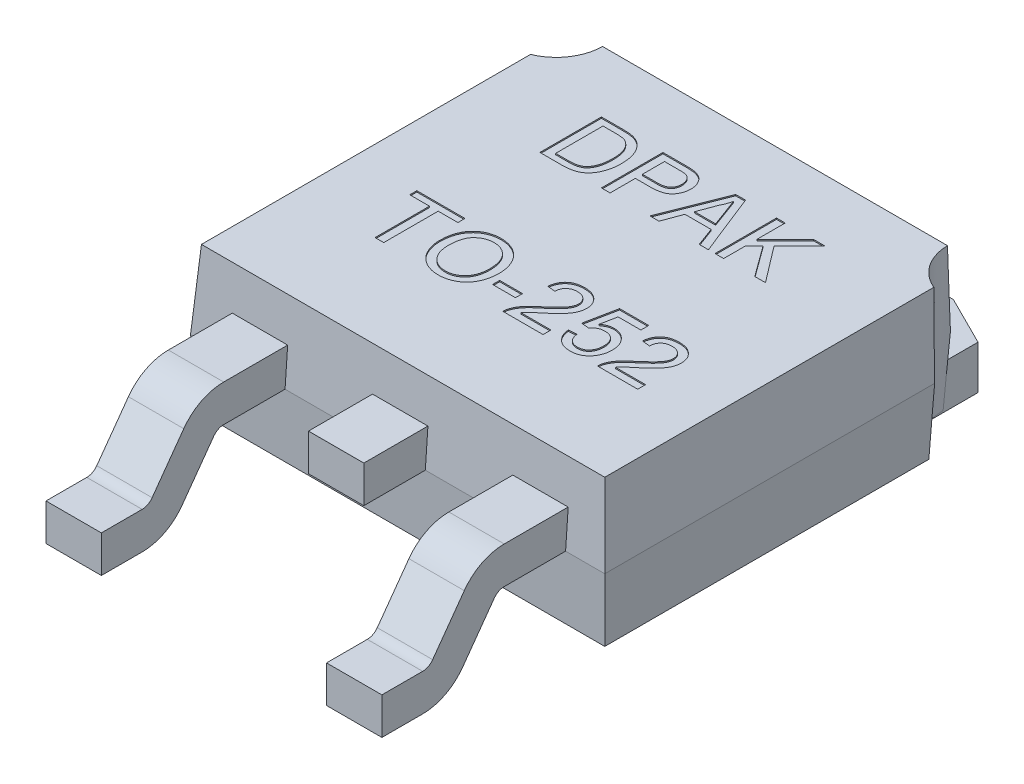
from build123d import *

# Parameters (mm, degrees)
SKETCH1_W                    = 6.58
SKETCH1_H                    = 6.07
BOSS_EXTRUDE1_DEPTH          = 1.1
BOSS_EXTRUDE1_DRAFT          = -4
BOSS_EXTRUDE2_DEPTH          = 0.68
BOSS_EXTRUDE2_DEPTH_BACK     = 0.03
CUT_EXTRUDE1_DEPTH           = 6.344296633
CUT_EXTRUDE1_DEPTH_BACK      = 6.344296633
SKETCH4_W                    = 0.22
SKETCH4_H                    = 3.853578182
CUT_EXTRUDE2_DEPTH           = 0.03
BOSS_EXTRUDE3_DEPTH          = 0.45
LPATTERN1_COUNT              = 2
LPATTERN1_PITCH              = 2.28
LPATTERN1_COL_COUNT          = 2
LPATTERN1_COL_PITCH          = 2.28
SKETCH6_W                    = 1.328337758
SKETCH6_H                    = 2.20416708
CUT_EXTRUDE3_DEPTH           = 8.177439149
SKETCH7_W                    = 6.733838986
SKETCH7_H                    = 6.223838986
BOSS_EXTRUDE4_DEPTH          = 1.27
BOSS_EXTRUDE4_TAPER          = 4
SKETCH8_W                    = 0.371794872
SKETCH8_H                    = 0.115384615
CUT_EXTRUDE4_DEPTH           = 0.02
SKETCH9_R                    = 0.848920415
CUT_EXTRUDE7_DEPTH           = 8.35796406
CUT_EXTRUDE7_DRAFT           = -2
CUT_EXTRUDE7_PROFILE_2_DEPTH = 8.35796406
CUT_EXTRUDE7_PROFILE_2_DRAFT = -2


with BuildPart() as part:
    # Sketch1 → Boss-Extrude1 (with draft: the straight prism first)
    with BuildSketch(Plane(origin=(0, 0, 0), x_dir=(1, 0, 0), z_dir=(0, 1, 0))):
        Rectangle(SKETCH1_W, SKETCH1_H)
    extrude(amount=BOSS_EXTRUDE1_DEPTH)
    # Boss-Extrude1: the draft: its side faces are tilted about the plane it starts from
    boss_extrude1_sides = [part.faces().sort_by_distance(p)[0] for p in [
        (3.29, 0.55, 0),
        (0, 0.55, -3.035),
        (-3.29, 0.55, 0),
        (0, 0.55, 3.035),
    ]]
    draft(boss_extrude1_sides, Plane(origin=(0, 0, 0), x_dir=(1, 0, 0), z_dir=(0, 1, 0)), BOSS_EXTRUDE1_DRAFT)

    # Sketch2 → Boss-Extrude2 (add, two sides: drawn at the far end of the back side and taken through both)
    with BuildSketch(Plane(origin=(0, 0, 0), x_dir=(1, 0, 0), z_dir=(0, 1, 0)).offset(-BOSS_EXTRUDE2_DEPTH_BACK)):
        Polygon((2.72, 0), (2.72, 3.601919493), (1.92, 4.001919493), (-1.92, 4.001919493), (-2.72, 3.601919493), (-2.72, 0), (-2.72, -1.498080507), (2.72, -1.498080507), align=None)
    extrude(amount=BOSS_EXTRUDE2_DEPTH + BOSS_EXTRUDE2_DEPTH_BACK)

    # Sketch3 → Cut-Extrude1 (cut, two sides: drawn at the far end of the back side and taken through both)
    with BuildSketch(Plane(origin=(0, 0, 0), x_dir=(1, 0, 0), z_dir=(0, 1, 0)).offset(-CUT_EXTRUDE1_DEPTH_BACK)):
        with BuildLine():
            Line((-1, 4.001919493), (-1, 3.675595954))
            ThreePointArc((-1, 3.675595954), (-0.985355339, 3.640240615), (-0.95, 3.625595954))
            Line((-0.95, 3.625595954), (0.95, 3.625595954))
            ThreePointArc((0.95, 3.625595954), (0.985355339, 3.640240615), (1, 3.675595954))
            Line((1, 3.675595954), (1, 4.001919493))
            Line((1, 4.001919493), (-1, 4.001919493))
        make_face()
    extrude(amount=CUT_EXTRUDE1_DEPTH + CUT_EXTRUDE1_DEPTH_BACK, mode=Mode.SUBTRACT)

    # Sketch4 → Cut-Extrude2 (cut)
    with BuildSketch(Plane.XZ.offset(0.03)):
        with BuildLine():
            Line((0, -1.855497675), (-1, -1.855497675))
            ThreePointArc((-1, -1.855497675), (-1.241809855, -2.105497675), (-1, -2.355497675))
            Line((-1, -2.355497675), (0, -2.355497675))
            Line((0, -2.355497675), (1, -2.355497675))
            ThreePointArc((1, -2.355497675), (1.241809855, -2.105497675), (1, -1.855497675))
            Line((1, -1.855497675), (0, -1.855497675))
        make_face()
        with Locations((-2.61, -0.428708584)):
            Rectangle(SKETCH4_W, SKETCH4_H)
        with Locations((2.61, -0.428708584)):
            Rectangle(SKETCH4_W, SKETCH4_H)
    extrude(amount=-CUT_EXTRUDE2_DEPTH, mode=Mode.SUBTRACT)

    # Sketch5 → Boss-Extrude3 (add, symmetric)
    with BuildSketch(Plane(origin=(0, 0, 0), x_dir=(0, 0, -1), z_dir=(1, 0, 0))):
        with BuildLine():
            Line((0, 1.1), (-4.109468706, 1.1))
            ThreePointArc((-4.109468706, 1.1), (-4.200652173, 1.078004425), (-4.271779313, 1.016855753))
            Line((-4.271779313, 1.016855753), (-4.786025331, 0.302576987))
            ThreePointArc((-4.786025331, 0.302576987), (-5.070533888, 0.0579823), (-5.435267757, -0.03))
            Line((-5.435267757, -0.03), (-6.098080507, -0.03))
            Line((-6.098080507, -0.03), (-6.098080507, 0.57))
            Line((-6.098080507, 0.57), (-5.435267757, 0.57))
            ThreePointArc((-5.435267757, 0.57), (-5.34408429, 0.591995575), (-5.27295715, 0.653144247))
            Line((-5.27295715, 0.653144247), (-4.758711132, 1.367423013))
            ThreePointArc((-4.758711132, 1.367423013), (-4.474202575, 1.6120177), (-4.109468706, 1.7))
            Line((-4.109468706, 1.7), (0, 1.7))
            Line((0, 1.7), (0, 1.1))
        make_face()
    boss_extrude3 = extrude(amount=BOSS_EXTRUDE3_DEPTH, both=True)

    # LPattern1: Boss-Extrude3 ×2
    with Locations(*[(i * LPATTERN1_PITCH, 0, 0) for i in range(1, LPATTERN1_COUNT)]):
        add(boss_extrude3)

    # LPattern1 col: Boss-Extrude3 ×2
    with Locations(*[(-i * LPATTERN1_COL_PITCH, 0, 0) for i in range(1, LPATTERN1_COL_COUNT)]):
        add(boss_extrude3)

    # Sketch6 → Cut-Extrude3 (cut, through all)
    with BuildSketch(Plane(origin=(0, 1.7, 0), x_dir=(1, 0, 0), z_dir=(0, 1, 0))):
        with Locations((0.009170669, -5.214003033)):
            Rectangle(SKETCH6_W, SKETCH6_H)
    extrude(amount=-CUT_EXTRUDE3_DEPTH, mode=Mode.SUBTRACT)

    # Sketch7 → Boss-Extrude4 (add)
    with BuildSketch(Plane(origin=(0, 1.1, 0), x_dir=(1, 0, 0), z_dir=(0, 1, 0))):
        Rectangle(SKETCH7_W, SKETCH7_H)
    extrude(amount=BOSS_EXTRUDE4_DEPTH, taper=BOSS_EXTRUDE4_TAPER)

    # Sketch8 → Cut-Extrude4 (cut)
    # profile 1 of 10: a face of its own
    with BuildSketch(Plane(origin=(0, 2.37, 0), x_dir=(1, 0, 0), z_dir=(0, 1, 0))):
        with BuildLine():
            Line((-1.821910054, 1.022300033), (-1.821910054, 2.022300033))
            Line((-1.821910054, 2.022300033), (-1.479962939, 2.022300033))
            add(Edge.make_bspline(
                [(-1.479962939, 2.022300033), (-1.470614561, 2.022257801), (-1.452449946, 2.02217574), (-1.426063998, 2.021652732), (-1.401357101, 2.020391242), (-1.378443103, 2.01885458), (-1.357206436, 2.016808647), (-1.337674233, 2.014520785), (-1.319831253, 2.011536567), (-1.308613176, 2.009056126), (-1.303280247, 2.007876956)],
                knots=[0, 0, 0, 0, 1.263127796, 2.454354013, 3.565393221, 4.605443485, 5.557051711, 6.447822442, 7.26211484, 8, 8, 8, 8], degree=3))
            add(Edge.make_bspline(
                [(-1.303280247, 2.007876956), (-1.289488374, 2.004258497), (-1.262392892, 1.997149681), (-1.224144769, 1.981159317), (-1.189031327, 1.961102324), (-1.168206846, 1.944581125), (-1.157847554, 1.936362533)],
                knots=[0, 0, 0, 0, 1.04477941, 2.052571232, 3.03123721, 4, 4, 4, 4], degree=3))
            add(Edge.make_bspline(
                [(-1.157847554, 1.936362533), (-1.151415529, 1.930714171), (-1.138522364, 1.91939188), (-1.120813678, 1.900737577), (-1.104385623, 1.880948394), (-1.088747518, 1.860365017), (-1.074899561, 1.838237031), (-1.061919045, 1.815201338), (-1.050596891, 1.79079535), (-1.040175019, 1.765417932), (-1.030889843, 1.738970171), (-1.023260536, 1.711469145), (-1.016251631, 1.683202032), (-1.011038634, 1.653859839), (-1.006487956, 1.623691452), (-1.003599064, 1.592524197), (-1.001724653, 1.560451114), (-1.001507436, 1.538729105), (-1.001397234, 1.527708687)],
                knots=[0, 0, 0, 0, 0.908997367, 1.822109427, 2.728529095, 3.640759027, 4.565643067, 5.499218265, 6.448003669, 7.421473682, 8.413047621, 9.423472075, 10.452328391, 11.505545429, 12.587978234, 13.692612971, 14.829372988, 16, 16, 16, 16], degree=3))
            add(Edge.make_bspline(
                [(-1.001397234, 1.527708687), (-1.001665856, 1.509266233), (-1.002188589, 1.473377652), (-1.007358215, 1.42117838), (-1.015357772, 1.372112772), (-1.026999995, 1.326475454), (-1.041338608, 1.284519546), (-1.056980791, 1.245902384), (-1.074986055, 1.211289377), (-1.094737425, 1.180387936), (-1.115900495, 1.153002541), (-1.138071323, 1.128722186), (-1.161315631, 1.107536126), (-1.185515342, 1.088888354), (-1.211927282, 1.073447487), (-1.240274367, 1.059582888), (-1.271476265, 1.048442689), (-1.304945388, 1.03869811), (-1.341074846, 1.031397707), (-1.379668995, 1.026033135), (-1.420879512, 1.022789112), (-1.449174363, 1.022466218), (-1.463736977, 1.022300033)],
                knots=[0, 0, 0, 0, 1.410753827, 2.745293735, 4.009435601, 5.211453015, 6.344066657, 7.400119332, 8.396481539, 9.324811333, 10.202671465, 11.041621015, 11.837259285, 12.606727868, 13.374311266, 14.17412185, 15.017911533, 15.905707008, 16.839601966, 17.835295848, 18.885883805, 20, 20, 20, 20], degree=3))
            Line((-1.463736977, 1.022300033), (-1.821910054, 1.022300033))
        make_face()
        with BuildLine():
            Line((-1.680884413, 1.137684649), (-1.474754606, 1.137684649))
            add(Edge.make_bspline(
                [(-1.474754606, 1.137684649), (-1.459724133, 1.137909649), (-1.431289827, 1.138335299), (-1.391173512, 1.141604279), (-1.356161214, 1.147242831), (-1.325864684, 1.155264968), (-1.299577715, 1.165638824), (-1.276431911, 1.177903199), (-1.255843429, 1.191820508), (-1.244245934, 1.202954937), (-1.238576721, 1.20839779)],
                knots=[0, 0, 0, 0, 1.423649224, 2.693227144, 3.808972214, 4.778671344, 5.656058397, 6.479437267, 7.256702014, 8, 8, 8, 8], degree=3))
            add(Edge.make_bspline(
                [(-1.238576721, 1.20839779), (-1.231199371, 1.216833232), (-1.216043757, 1.234162532), (-1.197171087, 1.264435898), (-1.1807132, 1.29849923), (-1.166955341, 1.336715155), (-1.155674253, 1.378954412), (-1.148150198, 1.425595343), (-1.143230908, 1.476320812), (-1.142698926, 1.51160356), (-1.142422875, 1.529912213)],
                knots=[0, 0, 0, 0, 0.782184731, 1.606876467, 2.483531085, 3.422528604, 4.441347086, 5.534669947, 6.720709839, 8, 8, 8, 8], degree=3))
            add(Edge.make_bspline(
                [(-1.142422875, 1.529912213), (-1.142593915, 1.54266806), (-1.142926409, 1.567464911), (-1.144999228, 1.603589765), (-1.149091277, 1.637399014), (-1.154324625, 1.668951135), (-1.161469941, 1.698145835), (-1.169640733, 1.725262831), (-1.179919869, 1.749947636), (-1.191649624, 1.772390819), (-1.204517301, 1.792741425), (-1.217925883, 1.811436573), (-1.231943987, 1.828414967), (-1.246868647, 1.843435036), (-1.26225121, 1.856940955), (-1.278378448, 1.868656215), (-1.295205231, 1.878577214), (-1.307029304, 1.883727281), (-1.312895631, 1.886282405)],
                knots=[0, 0, 0, 0, 1.460126857, 2.838427476, 4.139102445, 5.35666337, 6.496721546, 7.577303074, 8.594995104, 9.55219858, 10.472533725, 11.348579167, 12.184287935, 12.989560785, 13.769667798, 14.524891986, 15.268148459, 16, 16, 16, 16], degree=3))
            add(Edge.make_bspline(
                [(-1.312895631, 1.886282405), (-1.317479346, 1.887959846), (-1.327191938, 1.891514235), (-1.343043829, 1.895537268), (-1.360734699, 1.899239573), (-1.380438922, 1.901838108), (-1.402056844, 1.904363601), (-1.425722841, 1.90589829), (-1.451312795, 1.906593771), (-1.469011727, 1.906805815), (-1.478160054, 1.906915418)],
                knots=[0, 0, 0, 0, 0.699400087, 1.48198292, 2.341906832, 3.289648813, 4.329964754, 5.462247508, 6.688271602, 8, 8, 8, 8], degree=3))
            Line((-1.478160054, 1.906915418), (-1.680884413, 1.906915418))
            Line((-1.680884413, 1.906915418), (-1.680884413, 1.137684649))
        make_face(mode=Mode.SUBTRACT)
    # profile 2 of 10: a face of its own
    with BuildSketch(Plane(origin=(0, 2.37, 0), x_dir=(1, 0, 0), z_dir=(0, 1, 0))):
        with BuildLine():
            Line((-0.821910054, 1.022300033), (-0.821910054, 2.022300033))
            Line((-0.821910054, 2.022300033), (-0.454522234, 2.022300033))
            add(Edge.make_bspline(
                [(-0.454522234, 2.022300033), (-0.439294305, 2.022213278), (-0.410696183, 2.022050353), (-0.370759272, 2.020142282), (-0.336464799, 2.017781682), (-0.315750799, 2.014420802), (-0.306285054, 2.012884969)],
                knots=[0, 0, 0, 0, 1.22865052, 2.30741144, 3.226532197, 4, 4, 4, 4], degree=3))
            add(Edge.make_bspline(
                [(-0.306285054, 2.012884969), (-0.29473913, 2.01066293), (-0.272359912, 2.006356), (-0.240674406, 1.995972924), (-0.211807075, 1.983051979), (-0.185803033, 1.966953814), (-0.162230272, 1.948042409), (-0.14142473, 1.925382106), (-0.122982188, 1.89947887), (-0.107300394, 1.870352969), (-0.094247703, 1.839013512), (-0.085105547, 1.805626146), (-0.07924998, 1.770770931), (-0.078633643, 1.746950073), (-0.078320311, 1.734840097)],
                knots=[0, 0, 0, 0, 1.070909925, 2.075721949, 3.031861647, 3.947440733, 4.85625699, 5.777986723, 6.742441087, 7.747548058, 8.78749499, 9.830146138, 10.896896232, 12, 12, 12, 12], degree=3))
            add(Edge.make_bspline(
                [(-0.078320311, 1.734840097), (-0.078541129, 1.724478807), (-0.0789756, 1.704092399), (-0.082706335, 1.674141825), (-0.08859051, 1.645328154), (-0.097367556, 1.617848564), (-0.108097731, 1.591381791), (-0.12162023, 1.566374204), (-0.137410694, 1.54248622), (-0.155527256, 1.519782841), (-0.176855481, 1.498724771), (-0.202515958, 1.480861138), (-0.232013951, 1.465860707), (-0.265356338, 1.453740522), (-0.302462181, 1.444203889), (-0.343453059, 1.437216534), (-0.388408822, 1.433358933), (-0.419659237, 1.43283079), (-0.435892426, 1.432556443)],
                knots=[0, 0, 0, 0, 0.928769099, 1.82740408, 2.702266355, 3.562020322, 4.410419678, 5.259600434, 6.10654066, 6.975254961, 7.860221694, 8.783881459, 9.766664779, 10.81996744, 11.958551584, 13.197863772, 14.544415867, 16, 16, 16, 16], degree=3))
            Line((-0.435892426, 1.432556443), (-0.680884413, 1.432556443))
            Line((-0.680884413, 1.432556443), (-0.680884413, 1.022300033))
            Line((-0.680884413, 1.022300033), (-0.821910054, 1.022300033))
        make_face()
        with BuildLine():
            Line((-0.680884413, 1.547941059), (-0.439698516, 1.547941059))
            add(Edge.make_bspline(
                [(-0.439698516, 1.547941059), (-0.430079075, 1.5481019), (-0.411548112, 1.548411744), (-0.384771717, 1.550574009), (-0.360197593, 1.55431679), (-0.337757575, 1.559536873), (-0.317423088, 1.566025287), (-0.299230516, 1.574231345), (-0.283273671, 1.584074977), (-0.26944682, 1.595455877), (-0.257578029, 1.608205261), (-0.247294004, 1.622114135), (-0.23855614, 1.637281895), (-0.231706688, 1.653771999), (-0.225904257, 1.671263685), (-0.222282493, 1.690119381), (-0.219764291, 1.710065651), (-0.219487354, 1.723813945), (-0.219345952, 1.730833687)],
                knots=[0, 0, 0, 0, 1.403696362, 2.704090955, 3.91683431, 5.027708188, 6.063065288, 7.026749679, 7.932587242, 8.790956304, 9.632005367, 10.468072405, 11.310475089, 12.179234342, 13.069796908, 13.994719932, 14.976123913, 16, 16, 16, 16], degree=3))
            add(Edge.make_bspline(
                [(-0.219345952, 1.730833687), (-0.219644682, 1.741013433), (-0.220223517, 1.760738227), (-0.226055426, 1.789121598), (-0.235198627, 1.815348336), (-0.248289, 1.838921886), (-0.264132159, 1.859602168), (-0.282755456, 1.876522043), (-0.303561824, 1.890048859), (-0.319096848, 1.895404819), (-0.326918067, 1.898101315)],
                knots=[0, 0, 0, 0, 1.143156811, 2.215038775, 3.243253804, 4.254666983, 5.233799895, 6.158487526, 7.072877374, 8, 8, 8, 8], degree=3))
            add(Edge.make_bspline(
                [(-0.326918067, 1.898101315), (-0.329782448, 1.89880172), (-0.336006945, 1.900323747), (-0.346317775, 1.90205127), (-0.358267485, 1.903687082), (-0.371914321, 1.904772367), (-0.38713383, 1.905850192), (-0.403972538, 1.906347043), (-0.422468805, 1.906776181), (-0.435357896, 1.906867587), (-0.442102362, 1.906915418)],
                knots=[0, 0, 0, 0, 0.611063981, 1.327884044, 2.165719042, 3.110592661, 4.16481496, 5.328235826, 6.601947678, 8, 8, 8, 8], degree=3))
            Line((-0.442102362, 1.906915418), (-0.680884413, 1.906915418))
            Line((-0.680884413, 1.906915418), (-0.680884413, 1.547941059))
        make_face(mode=Mode.SUBTRACT)
    # profile 3 of 10: a face of its own
    with BuildSketch(Plane(origin=(0, 2.37, 0), x_dir=(1, 0, 0), z_dir=(0, 1, 0))):
        Polygon((-0.035652042, 1.022300033), (0.361383215, 2.022300033), (0.520437702, 2.022300033), (0.917472958, 1.022300033), (0.767833535, 1.022300033), (0.654051484, 1.329992341), (0.227769433, 1.329992341), (0.113987382, 1.022300033), align=None)
        with BuildLine():
            Line((0.270237382, 1.445376956), (0.611583535, 1.445376956))
            Line((0.611583535, 1.445376956), (0.514428087, 1.708197469))
            add(Edge.make_bspline(
                [(0.514428087, 1.708197469), (0.510703494, 1.718352496), (0.503421211, 1.73820749), (0.492561134, 1.76705512), (0.482639542, 1.794450014), (0.472910607, 1.819999368), (0.464128123, 1.844074311), (0.456033082, 1.86651223), (0.448027156, 1.887157168), (0.443222687, 1.900495926), (0.440910458, 1.906915418)],
                knots=[0, 0, 0, 0, 1.225184869, 2.395467751, 3.491410812, 4.525364584, 5.492066482, 6.394148129, 7.227157926, 8, 8, 8, 8], degree=3))
            add(Edge.make_bspline(
                [(0.440910458, 1.906915418), (0.437085587, 1.891085516), (0.429420072, 1.859360441), (0.413370351, 1.81287895), (0.395010028, 1.766822553), (0.380099257, 1.737144126), (0.372601164, 1.722219905)],
                knots=[0, 0, 0, 0, 0.9891762, 1.982431084, 2.985436691, 4, 4, 4, 4], degree=3))
            Line((0.372601164, 1.722219905), (0.270237382, 1.445376956))
        make_face(mode=Mode.SUBTRACT)
    # profile 4 of 10: a face of its own
    with BuildSketch(Plane(origin=(0, 2.37, 0), x_dir=(1, 0, 0), z_dir=(0, 1, 0))):
        Polygon((1.024243792, 1.022300033), (1.024243792, 2.022300033), (1.165269433, 2.022300033), (1.165269433, 1.561562854), (1.626006612, 2.022300033), (1.819115587, 2.022300033), (1.401246997, 1.604431443), (1.844756612, 1.022300033), (1.671078728, 1.022300033), (1.311904048, 1.514888174), (1.165269433, 1.368453879), (1.165269433, 1.022300033), align=None)
    # profile 5 of 10: a face of its own
    with BuildSketch(Plane(origin=(0, 2.37, 0), x_dir=(1, 0, 0), z_dir=(0, 1, 0))):
        Polygon((-1.962935695, -1.516161505), (-1.962935695, -0.631546121), (-2.283448516, -0.631546121), (-2.283448516, -0.516161505), (-1.501397234, -0.516161505), (-1.501397234, -0.631546121), (-1.821910054, -0.631546121), (-1.821910054, -1.516161505), align=None)
    # profile 6 of 10: a face of its own
    with BuildSketch(Plane(origin=(0, 2.37, 0), x_dir=(1, 0, 0), z_dir=(0, 1, 0))):
        with BuildLine():
            add(Edge.make_bspline(
                [(-1.398833131, -1.029382659), (-1.39848557, -1.009333521), (-1.397808364, -0.970268792), (-1.391480863, -0.913385513), (-1.381206626, -0.859865789), (-1.366518696, -0.809713788), (-1.347901702, -0.762850923), (-1.325269189, -0.719171079), (-1.297940386, -0.67916868), (-1.267024546, -0.642462931), (-1.232492973, -0.610012358), (-1.195726663, -0.5811916), (-1.156266519, -0.557151681), (-1.114477123, -0.537302633), (-1.07018093, -0.522063109), (-1.02350231, -0.511394055), (-0.974491187, -0.504511478), (-0.940990936, -0.503736822), (-0.923873195, -0.503340992)],
                knots=[0, 0, 0, 0, 1.203621547, 2.345195544, 3.432004029, 4.472479546, 5.478447225, 6.455936844, 7.420185704, 8.381829745, 9.332027588, 10.260832629, 11.182364398, 12.100723901, 13.034044877, 13.989196293, 14.972532542, 16, 16, 16, 16], degree=3))
            add(Edge.make_bspline(
                [(-0.923873195, -0.503340992), (-0.912582869, -0.503538143), (-0.890162323, -0.503929648), (-0.857015546, -0.506908477), (-0.824720525, -0.512225173), (-0.793309063, -0.51935014), (-0.762695656, -0.528697788), (-0.732862023, -0.539732402), (-0.704069324, -0.553405842), (-0.67612601, -0.568714619), (-0.64936193, -0.585838148), (-0.624209114, -0.604754475), (-0.600727812, -0.625320538), (-0.578602606, -0.647198286), (-0.558571783, -0.671126064), (-0.539807819, -0.696374989), (-0.522849907, -0.723392766), (-0.507637877, -0.75195803), (-0.494036776, -0.781629596), (-0.482412009, -0.81253044), (-0.472430034, -0.844289886), (-0.464074278, -0.877095915), (-0.458078798, -0.910937311), (-0.453304533, -0.945668256), (-0.450791705, -0.981402263), (-0.450342592, -1.005541221), (-0.450115183, -1.017764069)],
                knots=[0, 0, 0, 0, 1.034375294, 2.054082248, 3.045783978, 4.031219655, 5.002789406, 5.976610191, 6.94273282, 7.920236376, 8.894345378, 9.851183672, 10.800797181, 11.752517031, 12.698794154, 13.65688337, 14.632873302, 15.61821402, 16.620222298, 17.621258913, 18.640965868, 19.669244166, 20.720417492, 21.788124603, 22.880008887, 24, 24, 24, 24], degree=3))
            add(Edge.make_bspline(
                [(-0.450115183, -1.017764069), (-0.45032354, -1.030188473), (-0.450735185, -1.054735025), (-0.453520543, -1.090997793), (-0.458418171, -1.126219531), (-0.464914042, -1.160505266), (-0.473618309, -1.193783621), (-0.483961994, -1.226150007), (-0.496473265, -1.257411644), (-0.510603356, -1.287643879), (-0.526591549, -1.316430913), (-0.54422761, -1.343571454), (-0.563524034, -1.368811624), (-0.58418771, -1.392461055), (-0.60670119, -1.414096851), (-0.630787251, -1.433921323), (-0.656353282, -1.452121438), (-0.683485173, -1.468204279), (-0.711696004, -1.482301464), (-0.740427527, -1.494808207), (-0.769701086, -1.505474456), (-0.799616727, -1.51411839), (-0.830092845, -1.520650368), (-0.861043675, -1.525541583), (-0.89257068, -1.528357961), (-0.913785018, -1.52877293), (-0.924474157, -1.528982018)],
                knots=[0, 0, 0, 0, 1.141429366, 2.255090526, 3.338676798, 4.407031443, 5.458968682, 6.496860253, 7.526652771, 8.550250826, 9.560787671, 10.54935636, 11.521089193, 12.477323897, 13.431786008, 14.386110112, 15.340986122, 16.312041, 17.28047646, 18.236612773, 19.189437236, 20.140779471, 21.09494583, 22.051062463, 23.018000708, 24, 24, 24, 24], degree=3))
            add(Edge.make_bspline(
                [(-0.924474157, -1.528982018), (-0.935967356, -1.528811975), (-0.958732505, -1.528475162), (-0.992380007, -1.525113192), (-1.025190413, -1.51998439), (-1.057068337, -1.512579949), (-1.087970217, -1.502920333), (-1.117932619, -1.491228639), (-1.147060924, -1.477661124), (-1.174993696, -1.461829304), (-1.201635865, -1.444226023), (-1.226729205, -1.424938785), (-1.250259841, -1.404145338), (-1.271850201, -1.381501994), (-1.29219953, -1.35782958), (-1.310494171, -1.332248209), (-1.327331597, -1.305338039), (-1.342213561, -1.276839668), (-1.355657189, -1.247599959), (-1.366983735, -1.217609559), (-1.376937575, -1.187310448), (-1.3848648, -1.156515873), (-1.391181834, -1.125296872), (-1.395429582, -1.09370539), (-1.398497337, -1.06169438), (-1.398720637, -1.040207434), (-1.398833131, -1.029382659)],
                knots=[0, 0, 0, 0, 1.072727997, 2.12480551, 3.153819198, 4.171534612, 5.177148798, 6.173931848, 7.17235114, 8.174500385, 9.168706755, 10.151274001, 11.127173509, 12.097141049, 13.070188938, 14.039134204, 15.03036519, 16.031505612, 17.038625933, 18.033164522, 19.022845559, 20.014762458, 21.000193215, 21.994692725, 22.989758729, 24, 24, 24, 24], degree=3))
        make_face()
        with BuildLine():
            add(Edge.make_bspline(
                [(-1.25780749, -1.030985223), (-1.257591375, -1.045422412), (-1.257169966, -1.07357391), (-1.252348816, -1.114617298), (-1.245033492, -1.153343824), (-1.23495009, -1.189862204), (-1.221395527, -1.223811276), (-1.205189293, -1.255517258), (-1.185785719, -1.284769386), (-1.163612907, -1.31148583), (-1.139225354, -1.335485882), (-1.11316478, -1.35644865), (-1.085425325, -1.374003486), (-1.05631453, -1.388498751), (-1.025623307, -1.399813627), (-0.993443576, -1.407758647), (-0.959751693, -1.412727613), (-0.936777984, -1.413303861), (-0.925075118, -1.413597403)],
                knots=[0, 0, 0, 0, 1.215430442, 2.370003584, 3.475209778, 4.53279855, 5.55522989, 6.548792651, 7.526809858, 8.505409025, 9.467826767, 10.404123909, 11.316848639, 12.227335424, 13.138360512, 14.065900994, 15.014765094, 16, 16, 16, 16], degree=3))
            add(Edge.make_bspline(
                [(-0.925075118, -1.413597403), (-0.913173889, -1.413299519), (-0.889871315, -1.412716263), (-0.855671481, -1.40783404), (-0.823177811, -1.399522264), (-0.792068233, -1.388457406), (-0.762905179, -1.373499605), (-0.735006609, -1.355984101), (-0.709133041, -1.334580658), (-0.684649352, -1.310538159), (-0.662689132, -1.283209444), (-0.64320406, -1.253267706), (-0.627375759, -1.220263894), (-0.613710158, -1.184925037), (-0.603703417, -1.146583218), (-0.596307822, -1.105674306), (-0.59185108, -1.06206671), (-0.591381762, -1.032130904), (-0.591140824, -1.016762467)],
                knots=[0, 0, 0, 0, 0.976878588, 1.912725521, 2.8289017, 3.727303729, 4.617335839, 5.514666588, 6.426584173, 7.368641557, 8.327632997, 9.299405846, 10.294892156, 11.327373912, 12.405931897, 13.542618837, 14.738430195, 16, 16, 16, 16], degree=3))
            add(Edge.make_bspline(
                [(-0.591140824, -1.016762467), (-0.591225971, -1.006875414), (-0.591393, -0.987480596), (-0.593605018, -0.958892411), (-0.596458238, -0.931193483), (-0.60080231, -0.904419553), (-0.606788992, -0.878681497), (-0.61342122, -0.853783371), (-0.621714588, -0.829939734), (-0.63112457, -0.807057081), (-0.641654181, -0.785252885), (-0.653530181, -0.764710966), (-0.666614548, -0.745511186), (-0.680554249, -0.727289536), (-0.696121188, -0.710751268), (-0.712565805, -0.6951978), (-0.730261641, -0.680950468), (-0.749032097, -0.668005552), (-0.76861089, -0.656353087), (-0.788957658, -0.646380089), (-0.809748249, -0.637620064), (-0.831330668, -0.630905136), (-0.853406903, -0.625489449), (-0.876066197, -0.62137573), (-0.899392657, -0.619245454), (-0.915122147, -0.618900134), (-0.923071913, -0.618725608)],
                knots=[0, 0, 0, 0, 1.220438779, 2.394059227, 3.538503547, 4.658058814, 5.74010225, 6.800155734, 7.837851593, 8.854470756, 9.853724944, 10.825214244, 11.781044712, 12.72106398, 13.654479919, 14.581868691, 15.514082315, 16.456304431, 17.39516604, 18.324312202, 19.252140633, 20.177768678, 21.111585046, 22.057694709, 23.018348693, 24, 24, 24, 24], degree=3))
            add(Edge.make_bspline(
                [(-0.923071913, -0.618725608), (-0.934307824, -0.618948749), (-0.956477528, -0.61938903), (-0.989113972, -0.624283443), (-1.020579042, -0.631596366), (-1.050921569, -0.641820221), (-1.079882039, -0.655358211), (-1.107610492, -0.671960704), (-1.134353059, -0.69117564), (-1.159688049, -0.713471185), (-1.183305801, -0.739083324), (-1.203272241, -0.769279251), (-1.220100503, -0.803338126), (-1.234151791, -0.841173618), (-1.244865484, -0.883078737), (-1.252269986, -0.928873146), (-1.256945038, -0.978605101), (-1.257512657, -1.013078816), (-1.25780749, -1.030985223)],
                knots=[0, 0, 0, 0, 0.895090134, 1.766112571, 2.624765742, 3.468151641, 4.313618154, 5.168136083, 6.041303099, 6.935189387, 7.854749729, 8.809996334, 9.809869957, 10.877771942, 12.021723904, 13.25217762, 14.572720513, 16, 16, 16, 16], degree=3))
        make_face(mode=Mode.SUBTRACT)
    # profile 7 of 10: a face of its own
    with BuildSketch(Plane(origin=(0, 2.37, 0), x_dir=(1, 0, 0), z_dir=(0, 1, 0))):
        with Locations((-0.161653644, -1.163597402)):
            Rectangle(SKETCH8_W, SKETCH8_H)
    # profile 8 of 10: a face of its own
    with BuildSketch(Plane(origin=(0, 2.37, 0), x_dir=(1, 0, 0), z_dir=(0, 1, 0))):
        with BuildLine():
            Line((0.767833535, -1.387956377), (0.767833535, -1.516161505))
            Line((0.767833535, -1.516161505), (0.113987382, -1.516161505))
            add(Edge.make_bspline(
                [(0.113987382, -1.516161505), (0.113973996, -1.508541914), (0.113947269, -1.493328271), (0.116521662, -1.470828257), (0.120553678, -1.448626726), (0.125112676, -1.434389766), (0.127408856, -1.427219198)],
                knots=[0, 0, 0, 0, 1.01057331, 2.01775941, 3.001627217, 4, 4, 4, 4], degree=3))
            add(Edge.make_bspline(
                [(0.127408856, -1.427219198), (0.131651432, -1.415503343), (0.140290015, -1.391647935), (0.157791874, -1.357227912), (0.178378197, -1.323016054), (0.19842188, -1.295162772), (0.216777566, -1.272909947), (0.232171201, -1.255499686), (0.24923017, -1.237678233), (0.267940813, -1.219448842), (0.288123049, -1.20069345), (0.309804419, -1.181349507), (0.333240944, -1.16177751), (0.349602091, -1.148804375), (0.357977766, -1.142163108)],
                knots=[0, 0, 0, 0, 1.204657718, 2.452881516, 3.728232997, 5.065887527, 5.768225529, 6.518857853, 7.313994055, 8.154655305, 9.046094665, 9.979688118, 10.965752482, 12, 12, 12, 12], degree=3))
            add(Edge.make_bspline(
                [(0.357977766, -1.142163108), (0.370844872, -1.131333074), (0.395621301, -1.110479156), (0.4306095, -1.079533875), (0.462565525, -1.050799429), (0.490980513, -1.023772187), (0.516086867, -0.998714297), (0.537943538, -0.975682531), (0.556738588, -0.954748766), (0.572242566, -0.935155288), (0.585323748, -0.916653595), (0.596408894, -0.898606336), (0.605646893, -0.880698266), (0.61334091, -0.862986049), (0.619426223, -0.84539394), (0.62357423, -0.827870687), (0.626387265, -0.810590161), (0.626668711, -0.799091508), (0.626807894, -0.793405095)],
                knots=[0, 0, 0, 0, 1.782554561, 3.432421876, 4.950675607, 6.337395053, 7.588547463, 8.709982106, 9.702713005, 10.569305638, 11.356701089, 12.103210377, 12.812277205, 13.490692607, 14.148717897, 14.782152033, 15.397739362, 16, 16, 16, 16], degree=3))
            add(Edge.make_bspline(
                [(0.626807894, -0.793405095), (0.626668694, -0.78778503), (0.626395591, -0.776758768), (0.623804405, -0.760621902), (0.620197265, -0.745081715), (0.614365618, -0.730417963), (0.607424202, -0.716196397), (0.598520161, -0.7028664), (0.588220016, -0.690095753), (0.576427222, -0.678221159), (0.563546728, -0.667080894), (0.549154613, -0.657820628), (0.534196145, -0.649483629), (0.518155271, -0.642780204), (0.501058055, -0.637857759), (0.483028958, -0.634285332), (0.464070841, -0.632020222), (0.451133258, -0.63170655), (0.444516228, -0.631546121)],
                knots=[0, 0, 0, 0, 0.988194508, 1.938783882, 2.870742509, 3.789494954, 4.709148727, 5.651055405, 6.603531303, 7.592354411, 8.592907906, 9.593461401, 10.59787167, 11.603930315, 12.645063138, 13.723588815, 14.835711238, 16, 16, 16, 16], degree=3))
            add(Edge.make_bspline(
                [(0.444516228, -0.631546121), (0.437565221, -0.631705756), (0.423961591, -0.632018174), (0.404076726, -0.634292318), (0.385199494, -0.637766902), (0.367374951, -0.643079245), (0.350624792, -0.649771492), (0.335017238, -0.658195248), (0.320302345, -0.667704146), (0.306943543, -0.678961963), (0.294863354, -0.691444586), (0.284138958, -0.705034387), (0.275351927, -0.71999362), (0.268095234, -0.735993366), (0.262260246, -0.753083921), (0.258024243, -0.77139594), (0.255714746, -0.790876549), (0.255250325, -0.804216864), (0.255013023, -0.8110333)],
                knots=[0, 0, 0, 0, 1.131143733, 2.213731411, 3.253917892, 4.251203413, 5.236093891, 6.184197493, 7.13373276, 8.082770301, 9.020476205, 9.957489029, 10.893177274, 11.836722509, 12.812818608, 13.827831385, 14.890097571, 16, 16, 16, 16], degree=3))
            Line((0.255013023, -0.8110333), (0.126807894, -0.798212787))
            add(Edge.make_bspline(
                [(0.126807894, -0.798212787), (0.128119615, -0.787039397), (0.130671454, -0.765302528), (0.137027738, -0.733820335), (0.145951386, -0.704532871), (0.156629284, -0.677031807), (0.170015034, -0.651785295), (0.185146473, -0.628271139), (0.202993307, -0.607235108), (0.222709324, -0.588014118), (0.244510534, -0.571075368), (0.268192148, -0.556277018), (0.293743334, -0.543899112), (0.321021781, -0.533650722), (0.350090113, -0.525875011), (0.380907208, -0.520299092), (0.413522626, -0.516862032), (0.435893938, -0.516398346), (0.447320715, -0.516161505)],
                knots=[0, 0, 0, 0, 1.130804643, 2.199883102, 3.223565206, 4.205909148, 5.160801384, 6.091796021, 7.01151579, 7.927798993, 8.855738875, 9.7815393, 10.730299821, 11.705391175, 12.706931101, 13.751121791, 14.851322166, 16, 16, 16, 16], degree=3))
            add(Edge.make_bspline(
                [(0.447320715, -0.516161505), (0.458884264, -0.516359518), (0.481410127, -0.516745248), (0.514233929, -0.520692039), (0.545204093, -0.526839129), (0.574434156, -0.535406292), (0.601751421, -0.546640396), (0.627176903, -0.560365936), (0.650827832, -0.576449021), (0.672309051, -0.595082719), (0.691679227, -0.615424521), (0.708654331, -0.63713361), (0.722846334, -0.660117243), (0.734929944, -0.684062137), (0.743892803, -0.709474233), (0.750195651, -0.736008048), (0.754478619, -0.763686256), (0.75483252, -0.782571161), (0.755013023, -0.792203172)],
                knots=[0, 0, 0, 0, 1.195390245, 2.328627238, 3.413424916, 4.457841177, 5.473507151, 6.462241215, 7.441013641, 8.425227782, 9.397253344, 10.342087291, 11.269524934, 12.186751184, 13.110685745, 14.048630397, 15.004728144, 16, 16, 16, 16], degree=3))
            add(Edge.make_bspline(
                [(0.755013023, -0.792203172), (0.754737398, -0.802098972), (0.75418554, -0.821912411), (0.749878219, -0.851527659), (0.742508344, -0.880821515), (0.732737857, -0.910150504), (0.719389338, -0.939631031), (0.702525751, -0.969669781), (0.681604629, -1.000377713), (0.661484375, -1.026482868), (0.642755684, -1.04836557), (0.626154469, -1.066376313), (0.606947825, -1.085511522), (0.585856264, -1.106433895), (0.56201957, -1.128400853), (0.536122629, -1.152070209), (0.507598542, -1.176819076), (0.487797267, -1.193726314), (0.477569112, -1.202459582)],
                knots=[0, 0, 0, 0, 0.927118007, 1.856282007, 2.79721255, 3.754929441, 4.749232485, 5.824981375, 6.979078785, 8.228161913, 8.911614355, 9.677694854, 10.522803217, 11.452009355, 12.461436787, 13.560019032, 14.739651695, 16, 16, 16, 16], degree=3))
            add(Edge.make_bspline(
                [(0.477569112, -1.202459582), (0.468810242, -1.209590236), (0.452108426, -1.223187295), (0.428346856, -1.242899316), (0.407063717, -1.260974705), (0.387761306, -1.276823877), (0.371142603, -1.291213437), (0.356622239, -1.303513185), (0.344727746, -1.314341548), (0.326614539, -1.33079005), (0.303672617, -1.354235726), (0.286768027, -1.377017235), (0.278650843, -1.387956377)],
                knots=[0, 0, 0, 0, 1.241996727, 2.368296581, 3.394949853, 4.3125351, 5.114548721, 5.812230366, 6.404953749, 6.883082049, 8.503329734, 10, 10, 10, 10], degree=3))
            Line((0.278650843, -1.387956377), (0.767833535, -1.387956377))
        make_face()
    # profile 9 of 10: a face of its own
    with BuildSketch(Plane(origin=(0, 2.37, 0), x_dir=(1, 0, 0), z_dir=(0, 1, 0))):
        with BuildLine():
            Line((0.908859176, -1.246930736), (1.037064305, -1.234110223))
            add(Edge.make_bspline(
                [(1.037064305, -1.234110223), (1.038333737, -1.241333879), (1.040802979, -1.255385012), (1.045508394, -1.275724444), (1.051619389, -1.294620344), (1.058485764, -1.312236363), (1.06664761, -1.328386233), (1.075491037, -1.343324952), (1.085920052, -1.356522241), (1.09688476, -1.368668332), (1.108919366, -1.379371186), (1.122139994, -1.388394061), (1.136177779, -1.396265974), (1.151203697, -1.402711146), (1.167240777, -1.407428672), (1.184084909, -1.411159426), (1.201952992, -1.413039335), (1.214144263, -1.413409001), (1.220357574, -1.413597403)],
                knots=[0, 0, 0, 0, 1.237781394, 2.407677316, 3.51963579, 4.58689595, 5.594855907, 6.570874, 7.510833816, 8.428091223, 9.330271693, 10.221190844, 11.124215526, 12.043132878, 12.973586933, 13.941700858, 14.950982896, 16, 16, 16, 16], degree=3))
            add(Edge.make_bspline(
                [(1.220357574, -1.413597403), (1.227979914, -1.413413225), (1.242885732, -1.413053057), (1.264570875, -1.410006902), (1.285054248, -1.404984145), (1.304237842, -1.397955171), (1.322346548, -1.389213809), (1.338779619, -1.377895338), (1.354433079, -1.365172258), (1.368299623, -1.350003905), (1.380922074, -1.333490619), (1.391816198, -1.315465665), (1.400987511, -1.296182038), (1.408708754, -1.275643433), (1.414410329, -1.253732523), (1.418604298, -1.230565867), (1.421296658, -1.20612871), (1.421550202, -1.189379155), (1.421679689, -1.180824967)],
                knots=[0, 0, 0, 0, 1.052816602, 2.058828735, 3.018813999, 3.961574988, 4.877590722, 5.788574389, 6.712363302, 7.658909047, 8.620312049, 9.580784896, 10.562948504, 11.56722449, 12.607883026, 13.686460295, 14.818448981, 16, 16, 16, 16], degree=3))
            add(Edge.make_bspline(
                [(1.421679689, -1.180824967), (1.421532516, -1.172672937), (1.421245935, -1.156799044), (1.418832457, -1.133684017), (1.414760636, -1.111948897), (1.409492081, -1.091354123), (1.402230042, -1.072221516), (1.393616856, -1.054273671), (1.38306534, -1.037891494), (1.371326082, -1.022564903), (1.357918368, -1.008825232), (1.342661061, -0.99722382), (1.326152697, -0.987070242), (1.308060779, -0.978836323), (1.288374656, -0.972718831), (1.267289952, -0.968011972), (1.244587882, -0.965536356), (1.228976485, -0.965102355), (1.220958535, -0.964879454)],
                knots=[0, 0, 0, 0, 1.165854935, 2.270189951, 3.319242023, 4.32700288, 5.306253956, 6.24172124, 7.169108591, 8.088047231, 8.999810445, 9.905349262, 10.822648491, 11.767237767, 12.739852311, 13.766490849, 14.852878837, 16, 16, 16, 16], degree=3))
            add(Edge.make_bspline(
                [(1.220958535, -0.964879454), (1.210988604, -0.965171094), (1.191868532, -0.965730393), (1.164394954, -0.970435579), (1.139384762, -0.978036208), (1.117121119, -0.98936402), (1.097229655, -1.002896953), (1.079297134, -1.01821008), (1.063175685, -1.035293048), (1.054332414, -1.04815454), (1.049884817, -1.054623044)],
                knots=[0, 0, 0, 0, 1.182877094, 2.268490576, 3.298955169, 4.273890847, 5.221533034, 6.149304476, 7.069219215, 8, 8, 8, 8], degree=3))
            Line((1.049884817, -1.054623044), (0.921679689, -1.041802531))
            Line((0.921679689, -1.041802531), (1.024243792, -0.528982018))
            Line((1.024243792, -0.528982018), (1.498602766, -0.528982018))
            Line((1.498602766, -0.528982018), (1.498602766, -0.657187146))
            Line((1.498602766, -0.657187146), (1.12901142, -0.657187146))
            Line((1.12901142, -0.657187146), (1.07813001, -0.916201569))
            add(Edge.make_bspline(
                [(1.07813001, -0.916201569), (1.085204025, -0.910893129), (1.099096273, -0.900468191), (1.120765689, -0.88681811), (1.142744956, -0.875312002), (1.164906125, -0.865889466), (1.187425233, -0.858549328), (1.210166389, -0.853449739), (1.233207023, -0.850003136), (1.248657126, -0.849664754), (1.256415266, -0.849494839)],
                knots=[0, 0, 0, 0, 1.093835215, 2.148119334, 3.164235237, 4.159999629, 5.123971815, 6.089888814, 7.040853737, 8, 8, 8, 8], degree=3))
            add(Edge.make_bspline(
                [(1.256415266, -0.849494839), (1.266511959, -0.84975938), (1.286394796, -0.850280326), (1.315692845, -0.854560554), (1.343706708, -0.861826525), (1.370656124, -0.871612729), (1.396185733, -0.884586014), (1.420554132, -0.900293907), (1.443662937, -0.918865884), (1.465381508, -0.939951531), (1.485081115, -0.963358815), (1.502712906, -0.988324341), (1.51711359, -1.015347849), (1.529225554, -1.043723751), (1.538360656, -1.073917848), (1.545294518, -1.105501623), (1.549001823, -1.138869947), (1.549585879, -1.161586008), (1.549884817, -1.173212787)],
                knots=[0, 0, 0, 0, 0.991958705, 1.953407265, 2.902004973, 3.832128134, 4.765371166, 5.71007953, 6.676509202, 7.674246545, 8.68000108, 9.679398714, 10.671856529, 11.683459888, 12.706765812, 13.76733029, 14.85725088, 16, 16, 16, 16], degree=3))
            add(Edge.make_bspline(
                [(1.549884817, -1.173212787), (1.549657818, -1.184306646), (1.549209429, -1.206220184), (1.54553479, -1.238513832), (1.539481696, -1.269631304), (1.531378273, -1.299664748), (1.520429461, -1.328443598), (1.507149577, -1.356060811), (1.491830485, -1.382804563), (1.479545369, -1.399290543), (1.473362382, -1.407587787)],
                knots=[0, 0, 0, 0, 1.059692978, 2.093196008, 3.100373587, 4.086253034, 5.061402885, 6.037282833, 7.012182238, 8, 8, 8, 8], degree=3))
            add(Edge.make_bspline(
                [(1.473362382, -1.407587787), (1.465507069, -1.417273283), (1.450054826, -1.436325692), (1.423299436, -1.461054579), (1.394537012, -1.482070729), (1.363596387, -1.499144828), (1.330685273, -1.512865313), (1.295399367, -1.52199578), (1.25816504, -1.528127251), (1.232602951, -1.528693175), (1.219556292, -1.528982018)],
                knots=[0, 0, 0, 0, 1.023140956, 2.012628108, 2.982342558, 3.942221589, 4.908720554, 5.902469194, 6.929439212, 8, 8, 8, 8], degree=3))
            add(Edge.make_bspline(
                [(1.219556292, -1.528982018), (1.208794868, -1.528763724), (1.187743363, -1.528336698), (1.156920213, -1.524624333), (1.127603753, -1.51870442), (1.099784798, -1.510213432), (1.073379538, -1.499484275), (1.048694898, -1.485854566), (1.025302503, -1.470263027), (1.003716909, -1.452229287), (0.984049622, -1.432114734), (0.966427333, -1.410345552), (0.951088521, -1.386907546), (0.938040587, -1.361940963), (0.927165738, -1.335469747), (0.918846047, -1.307313223), (0.912256161, -1.277747649), (0.910003377, -1.257310748), (0.908859176, -1.246930736)],
                knots=[0, 0, 0, 0, 1.108768375, 2.168973506, 3.19473529, 4.187459816, 5.162590879, 6.12651078, 7.088512529, 8.056012598, 9.019588496, 9.983680353, 10.938070192, 11.90157236, 12.88306954, 13.882379887, 14.924449348, 16, 16, 16, 16], degree=3))
        make_face()
    # profile 10 of 10: a face of its own
    with BuildSketch(Plane(origin=(0, 2.37, 0), x_dir=(1, 0, 0), z_dir=(0, 1, 0))):
        with BuildLine():
            Line((2.306295074, -1.387956377), (2.306295074, -1.516161505))
            Line((2.306295074, -1.516161505), (1.65244892, -1.516161505))
            add(Edge.make_bspline(
                [(1.65244892, -1.516161505), (1.652435534, -1.508541914), (1.652408807, -1.493328271), (1.6549832, -1.470828257), (1.659015216, -1.448626726), (1.663574215, -1.434389766), (1.665870394, -1.427219198)],
                knots=[0, 0, 0, 0, 1.01057331, 2.01775941, 3.001627217, 4, 4, 4, 4], degree=3))
            add(Edge.make_bspline(
                [(1.665870394, -1.427219198), (1.67011297, -1.415503343), (1.678751553, -1.391647935), (1.696253413, -1.357227912), (1.716839736, -1.323016054), (1.736883419, -1.295162772), (1.755239104, -1.272909947), (1.770632739, -1.255499686), (1.787691709, -1.237678233), (1.806402351, -1.219448842), (1.826584588, -1.20069345), (1.848265957, -1.181349507), (1.871702482, -1.16177751), (1.888063629, -1.148804375), (1.896439305, -1.142163108)],
                knots=[0, 0, 0, 0, 1.204657718, 2.452881516, 3.728232997, 5.065887527, 5.768225529, 6.518857853, 7.313994055, 8.154655305, 9.046094665, 9.979688118, 10.965752482, 12, 12, 12, 12], degree=3))
            add(Edge.make_bspline(
                [(1.896439305, -1.142163108), (1.90930641, -1.131333074), (1.934082839, -1.110479156), (1.969071039, -1.079533875), (2.001027064, -1.050799429), (2.029442051, -1.023772187), (2.054548406, -0.998714297), (2.076405077, -0.975682531), (2.095200127, -0.954748766), (2.110704105, -0.935155288), (2.123785286, -0.916653595), (2.134870433, -0.898606336), (2.144108431, -0.880698266), (2.151802448, -0.862986049), (2.157887762, -0.84539394), (2.162035768, -0.827870687), (2.164848803, -0.810590161), (2.165130249, -0.799091508), (2.165269433, -0.793405095)],
                knots=[0, 0, 0, 0, 1.782554561, 3.432421876, 4.950675607, 6.337395053, 7.588547463, 8.709982106, 9.702713005, 10.569305638, 11.356701089, 12.103210377, 12.812277205, 13.490692607, 14.148717897, 14.782152033, 15.397739362, 16, 16, 16, 16], degree=3))
            add(Edge.make_bspline(
                [(2.165269433, -0.793405095), (2.165130233, -0.78778503), (2.16485713, -0.776758768), (2.162265943, -0.760621902), (2.158658803, -0.745081715), (2.152827156, -0.730417963), (2.14588574, -0.716196397), (2.136981699, -0.7028664), (2.126681554, -0.690095753), (2.11488876, -0.678221159), (2.102008267, -0.667080894), (2.087616151, -0.657820628), (2.072657684, -0.649483629), (2.056616809, -0.642780204), (2.039519594, -0.637857759), (2.021490497, -0.634285332), (2.002532379, -0.632020222), (1.989594797, -0.63170655), (1.982977766, -0.631546121)],
                knots=[0, 0, 0, 0, 0.988194508, 1.938783882, 2.870742509, 3.789494954, 4.709148727, 5.651055405, 6.603531303, 7.592354411, 8.592907906, 9.593461401, 10.59787167, 11.603930315, 12.645063138, 13.723588815, 14.835711238, 16, 16, 16, 16], degree=3))
            add(Edge.make_bspline(
                [(1.982977766, -0.631546121), (1.97602676, -0.631705756), (1.962423129, -0.632018174), (1.942538264, -0.634292318), (1.923661032, -0.637766902), (1.905836489, -0.643079245), (1.889086331, -0.649771492), (1.873478776, -0.658195248), (1.858763884, -0.667704146), (1.845405082, -0.678961963), (1.833324892, -0.691444586), (1.822600496, -0.705034387), (1.813813465, -0.71999362), (1.806556773, -0.735993366), (1.800721785, -0.753083921), (1.796485781, -0.77139594), (1.794176284, -0.790876549), (1.793711864, -0.804216864), (1.793474561, -0.8110333)],
                knots=[0, 0, 0, 0, 1.131143733, 2.213731411, 3.253917892, 4.251203413, 5.236093891, 6.184197493, 7.13373276, 8.082770301, 9.020476205, 9.957489029, 10.893177274, 11.836722509, 12.812818608, 13.827831385, 14.890097571, 16, 16, 16, 16], degree=3))
            Line((1.793474561, -0.8110333), (1.665269433, -0.798212787))
            add(Edge.make_bspline(
                [(1.665269433, -0.798212787), (1.666581153, -0.787039397), (1.669132993, -0.765302528), (1.675489277, -0.733820335), (1.684412925, -0.704532871), (1.695090822, -0.677031807), (1.708476573, -0.651785295), (1.723608012, -0.628271139), (1.741454846, -0.607235108), (1.761170862, -0.588014118), (1.782972072, -0.571075368), (1.806653686, -0.556277018), (1.832204872, -0.543899112), (1.859483319, -0.533650722), (1.888551651, -0.525875011), (1.919368746, -0.520299092), (1.951984164, -0.516862032), (1.974355476, -0.516398346), (1.985782253, -0.516161505)],
                knots=[0, 0, 0, 0, 1.130804643, 2.199883102, 3.223565206, 4.205909148, 5.160801384, 6.091796021, 7.01151579, 7.927798993, 8.855738875, 9.7815393, 10.730299821, 11.705391175, 12.706931101, 13.751121791, 14.851322166, 16, 16, 16, 16], degree=3))
            add(Edge.make_bspline(
                [(1.985782253, -0.516161505), (1.997345803, -0.516359518), (2.019871665, -0.516745248), (2.052695467, -0.520692039), (2.083665632, -0.526839129), (2.112895694, -0.535406292), (2.14021296, -0.546640396), (2.165638441, -0.560365936), (2.189289371, -0.576449021), (2.210770589, -0.595082719), (2.230140766, -0.615424521), (2.247115869, -0.63713361), (2.261307872, -0.660117243), (2.273391482, -0.684062137), (2.282354342, -0.709474233), (2.28865719, -0.736008048), (2.292940158, -0.763686256), (2.293294058, -0.782571161), (2.293474561, -0.792203172)],
                knots=[0, 0, 0, 0, 1.195390245, 2.328627238, 3.413424916, 4.457841177, 5.473507151, 6.462241215, 7.441013641, 8.425227782, 9.397253344, 10.342087291, 11.269524934, 12.186751184, 13.110685745, 14.048630397, 15.004728144, 16, 16, 16, 16], degree=3))
            add(Edge.make_bspline(
                [(2.293474561, -0.792203172), (2.293198936, -0.802098972), (2.292647079, -0.821912411), (2.288339758, -0.851527659), (2.280969883, -0.880821515), (2.271199395, -0.910150504), (2.257850877, -0.939631031), (2.24098729, -0.969669781), (2.220066167, -1.000377713), (2.199945913, -1.026482868), (2.181217222, -1.04836557), (2.164616008, -1.066376313), (2.145409363, -1.085511522), (2.124317802, -1.106433895), (2.100481109, -1.128400853), (2.074584167, -1.152070209), (2.046060081, -1.176819076), (2.026258806, -1.193726314), (2.016030651, -1.202459582)],
                knots=[0, 0, 0, 0, 0.927118007, 1.856282007, 2.79721255, 3.754929441, 4.749232485, 5.824981375, 6.979078785, 8.228161913, 8.911614355, 9.677694854, 10.522803217, 11.452009355, 12.461436787, 13.560019032, 14.739651695, 16, 16, 16, 16], degree=3))
            add(Edge.make_bspline(
                [(2.016030651, -1.202459582), (2.007271781, -1.209590236), (1.990569964, -1.223187295), (1.966808395, -1.242899316), (1.945525256, -1.260974705), (1.926222844, -1.276823877), (1.909604142, -1.291213437), (1.895083778, -1.303513185), (1.883189284, -1.314341548), (1.865076077, -1.33079005), (1.842134155, -1.354235726), (1.825229566, -1.377017235), (1.817112382, -1.387956377)],
                knots=[0, 0, 0, 0, 1.241996727, 2.368296581, 3.394949853, 4.3125351, 5.114548721, 5.812230366, 6.404953749, 6.883082049, 8.503329734, 10, 10, 10, 10], degree=3))
            Line((1.817112382, -1.387956377), (2.306295074, -1.387956377))
        make_face()
    extrude(amount=-CUT_EXTRUDE4_DEPTH, mode=Mode.SUBTRACT)


with BuildPart() as cut_extrude7_tool:
    # Sketch9 → Cut-Extrude7 (with draft: the straight prism first)
    with BuildSketch(Plane.XZ):
        with Locations((-3.568920415, -3.035)):
            Circle(SKETCH9_R)
    extrude(amount=-CUT_EXTRUDE7_DEPTH)
    # Cut-Extrude7: the draft: its side faces are tilted about the plane it starts from
    cut_extrude7_sides = [cut_extrude7_tool.faces().sort_by_distance(p)[0] for p in [
        (-4.417840831, 4.17898203, -3.035),
    ]]
    draft(cut_extrude7_sides, Plane.XZ, CUT_EXTRUDE7_DRAFT)


with BuildPart() as part_1:
    add(part.part)

    # Cut-Extrude7: cut by cut_extrude7_tool
    add(cut_extrude7_tool.part, mode=Mode.SUBTRACT)


with BuildPart() as cut_extrude7_profile_2_tool:
    # Sketch9 → Cut-Extrude7 profile 2 (with draft: the straight prism first)
    with BuildSketch(Plane.XZ):
        with Locations((3.568920415, -3.035)):
            Circle(SKETCH9_R)
    extrude(amount=-CUT_EXTRUDE7_PROFILE_2_DEPTH)
    # Cut-Extrude7 profile 2: the draft: its side faces are tilted about the plane it starts from
    cut_extrude7_profile_2_sides = [cut_extrude7_profile_2_tool.faces().sort_by_distance(p)[0] for p in [
        (2.72, 4.17898203, -3.035),
    ]]
    draft(cut_extrude7_profile_2_sides, Plane.XZ, CUT_EXTRUDE7_PROFILE_2_DRAFT)


with BuildPart() as part_2:
    add(part_1.part)

    # Cut-Extrude7 profile 2: cut by cut_extrude7_profile_2_tool
    add(cut_extrude7_profile_2_tool.part, mode=Mode.SUBTRACT)


solid = part_2.part
